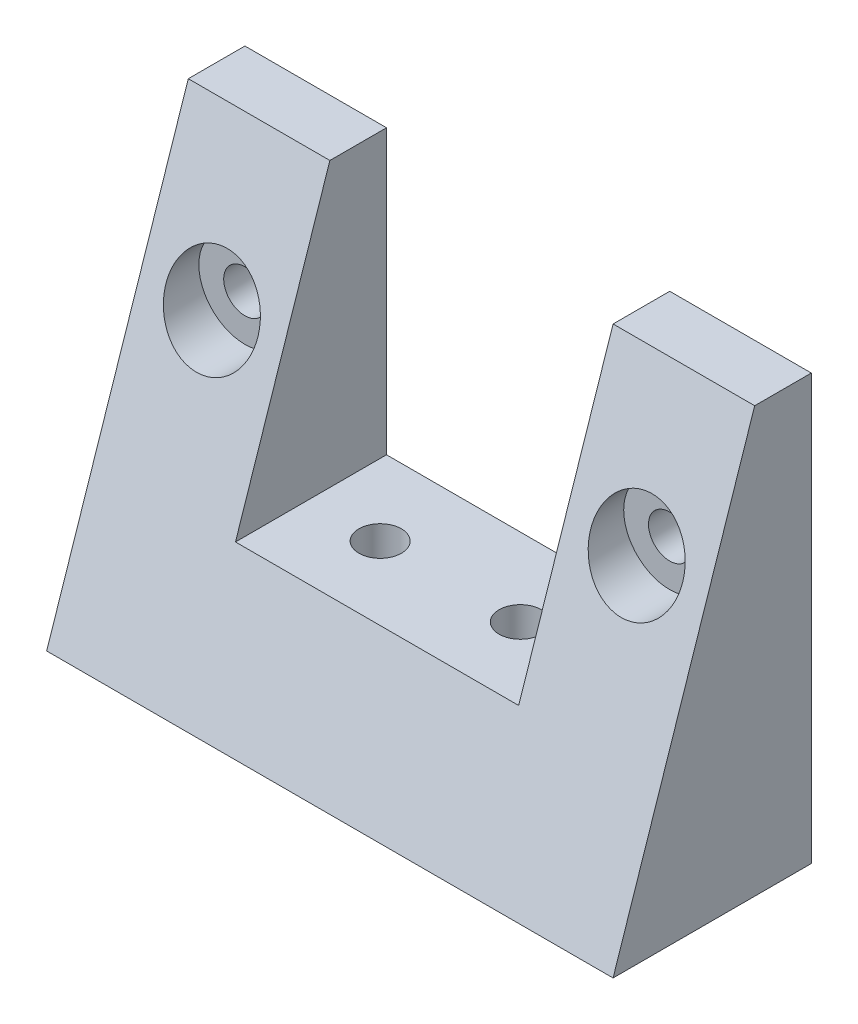
from build123d import *

# Parameters (mm, degrees)
EXTRUDE1_DEPTH = 40
SKETCH2_W      = 20
SKETCH2_H      = 20
EXTRUDE2_DEPTH = 52.923019943
SKETCH3_R      = 1.5
EXTRUDE3_DEPTH = 52.923019943
SKETCH4_R      = 1.5
EXTRUDE4_DEPTH = 47.861498055
SKETCH8_R      = 3.25
EXTRUDE5_DEPTH = 9


with BuildPart() as part:
    # Sketch1 → Extrude1 (new body)
    with BuildSketch(Plane(origin=(0, 0, 0), x_dir=(0, 0, -1), z_dir=(1, 0, 0))):
        Polygon((0, 0), (-14, 0), (-4, 30), (0, 30), align=None)
    extrude(amount=-EXTRUDE1_DEPTH)

    # Sketch2 → Extrude2 (cut, through all)
    with BuildSketch(Plane(origin=(0, 0, 0), x_dir=(-1, 0, 0), z_dir=(0, 0, -1))):
        with Locations((20, 20)):
            Rectangle(SKETCH2_W, SKETCH2_H)
    extrude(amount=-EXTRUDE2_DEPTH, mode=Mode.SUBTRACT)

    # Sketch3 → Extrude3 (cut, through all)
    with BuildSketch(Plane(origin=(0, 0, 0), x_dir=(-1, 0, 0), z_dir=(0, 0, -1))):
        with Locations(Location((5, 20, 0), (0, 0, 90))):
            Circle(SKETCH3_R)
        with Locations(Location((35, 20, 0), (0, 0, 90))):
            Circle(SKETCH3_R)
    extrude(amount=-EXTRUDE3_DEPTH, mode=Mode.SUBTRACT)

    # Sketch4 → Extrude4 (cut, through all)
    with BuildSketch(Plane(origin=(0, 10, 0), x_dir=(1, 0, 0), z_dir=(0, 1, 0))):
        with Locations(Location((-24.95, -5.5, 0), (0, 0, 270))):
            Circle(SKETCH4_R)
        with Locations(Location((-15.05, -5.5, 0), (0, 0, 90))):
            Circle(SKETCH4_R)
    extrude(amount=-EXTRUDE4_DEPTH, mode=Mode.SUBTRACT)

    # Sketch8 → Extrude5 (cut)
    with BuildSketch(Plane(origin=(0, 0, 14), x_dir=(-1, 0, 0), z_dir=(0, 0, -1))):
        with Locations(Location((5, 20, 0), (0, 0, 270))):
            Circle(SKETCH8_R)
        with Locations(Location((35, 20, 0), (0, 0, 270))):
            Circle(SKETCH8_R)
    extrude(amount=EXTRUDE5_DEPTH, mode=Mode.SUBTRACT)


solid = part.part
